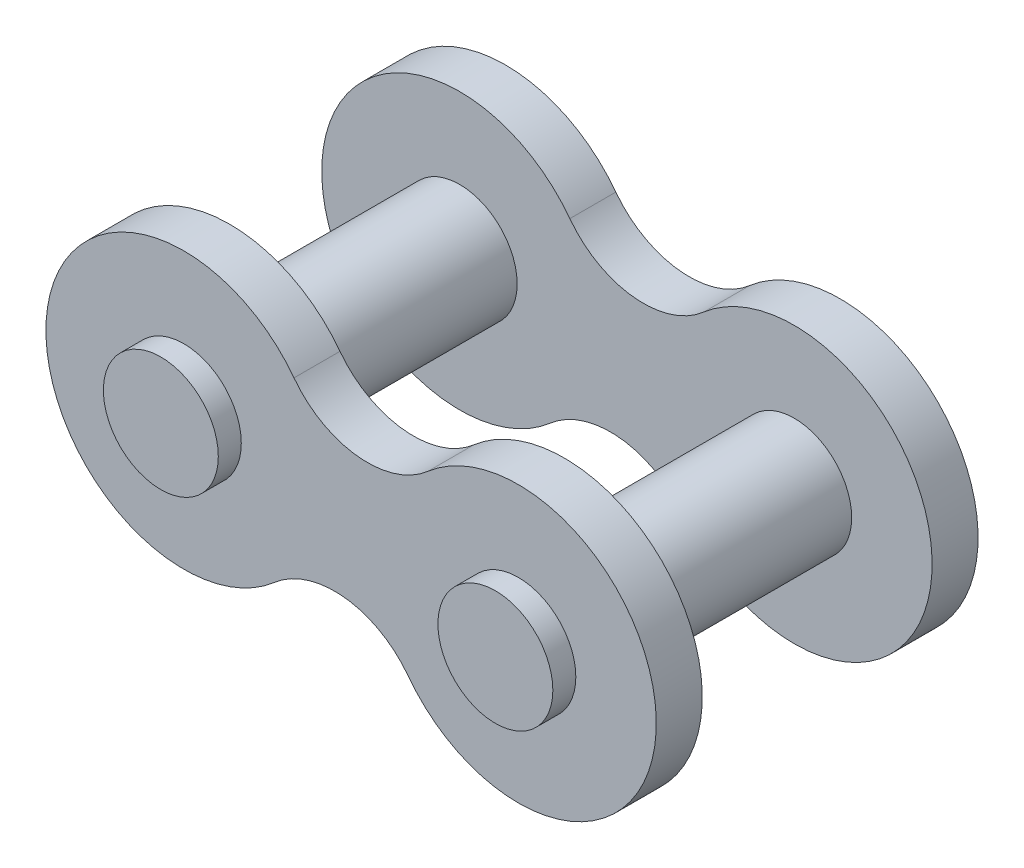
from build123d import *

# Parameters (mm, degrees)
IZIM1_R                       = 2.5
Y_KSEKLIK_EKSTR_ZYON1_DEPTH   = 2
Y_KSEKLIK_EKSTR_ZYON2_START   = -10
IZIM1_2_R                     = 2.5
Y_KSEKLIK_EKSTR_ZYON2_DEPTH   = 2
Y_KSEKLIK_EKSTR_ZYON3_START   = -5
IZIM1_6_R                     = 2.5
Y_KSEKLIK_EKSTR_ZYON3_DEPTH   = 8
Y_KSEKLIK_EKSTR_ZYON3_2_DEPTH = 8


with BuildPart() as part:
    # Çizim1 → Yükseklik-Ekstrüzyon1 (new body)
    with BuildSketch(Plane.XY):
        with BuildLine():
            ThreePointArc((9.760175922, 64.861870856), (20.520949729, 67.843161272), (10.615169778, 72.996594016))
            ThreePointArc((10.615169778, 72.996594016), (7.571290206, 72.036014411), (4.793642436, 73.608461196))
            ThreePointArc((4.793642436, 73.608461196), (-5.967131372, 70.62717078), (3.938648579, 65.473738035))
            ThreePointArc((3.938648579, 65.473738035), (6.982528151, 66.43431764), (9.760175922, 64.861870856))
        make_face()
        with Locations((0, 70)):
            Circle(IZIM1_R, mode=Mode.SUBTRACT)
        with Locations((14.553818357, 68.470332051)):
            Circle(IZIM1_R, mode=Mode.SUBTRACT)
    extrude(amount=Y_KSEKLIK_EKSTR_ZYON1_DEPTH)


with BuildPart() as body_2:
    # Çizim1<2> → Yükseklik-Ekstrüzyon2 (new body)
    with BuildSketch(Plane.XY.offset(Y_KSEKLIK_EKSTR_ZYON2_START)):
        with BuildLine():
            ThreePointArc((9.760175922, 64.861870856), (20.520949729, 67.843161272), (10.615169778, 72.996594016))
            ThreePointArc((10.615169778, 72.996594016), (7.571290206, 72.036014411), (4.793642436, 73.608461196))
            ThreePointArc((4.793642436, 73.608461196), (-5.967131372, 70.62717078), (3.938648579, 65.473738035))
            ThreePointArc((3.938648579, 65.473738035), (6.982528151, 66.43431764), (9.760175922, 64.861870856))
        make_face()
        with Locations((0, 70)):
            Circle(IZIM1_2_R, mode=Mode.SUBTRACT)
        with Locations((14.553818357, 68.470332051)):
            Circle(IZIM1_2_R, mode=Mode.SUBTRACT)
    extrude(amount=-Y_KSEKLIK_EKSTR_ZYON2_DEPTH)


with BuildPart() as body_3:
    # Çizim1<6> → Yükseklik-Ekstrüzyon3 (new, symmetric)
    with BuildSketch(Plane.XY.offset(Y_KSEKLIK_EKSTR_ZYON3_START)):
        with Locations((0, 70)):
            Circle(IZIM1_6_R)
    extrude(amount=Y_KSEKLIK_EKSTR_ZYON3_DEPTH, both=True)


with BuildPart() as body_4:
    # Çizim1<6> → Y_kseklik-Ekstr_zyon3 2 (new, symmetric)
    with BuildSketch(Plane.XY.offset(Y_KSEKLIK_EKSTR_ZYON3_START)):
        with Locations((14.553818357, 68.470332051)):
            Circle(IZIM1_6_R)
    extrude(amount=Y_KSEKLIK_EKSTR_ZYON3_2_DEPTH, both=True)


solid = Compound([part.part, body_2.part, body_3.part, body_4.part])
